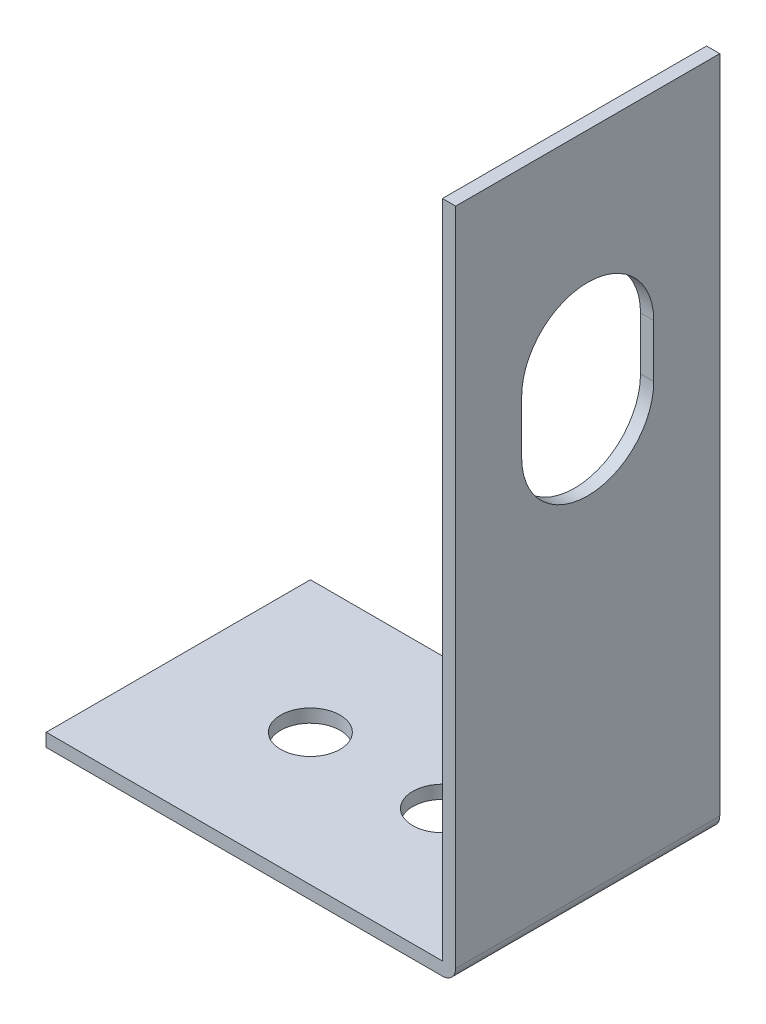
from build123d import *

# Parameters (mm, degrees)
EXTRUSION1_DEPTH        = 20
ENL_V_MAT_EXTRU_1_DEPTH = 62.64414003
ESQUISSE3_R             = 2.25
ENL_V_MAT_EXTRU_2_DEPTH = 62.64414003


with BuildPart() as part:
    # Esquisse1 → Extrusion1 (new body)
    with BuildSketch(Plane.XY):
        with BuildLine():
            Line((0, 0), (0, 50))
            Line((0, 50), (1, 50))
            Line((1, 50), (1, 0))
            ThreePointArc((1, 0), (0.707106781, -0.707106781), (0, -1))
            Line((0, -1), (-30, -1))
            Line((-30, -1), (-30, 0))
            Line((-30, 0), (0, 0))
        make_face()
    extrude(amount=EXTRUSION1_DEPTH)

    # Esquisse2 → Enlèv. mat.-Extru.1 (cut, through all)
    with BuildSketch(Plane.ZY):
        with BuildLine():
            Line((5, 35), (5, 31))
            ThreePointArc((5, 31), (10, 26), (15, 31))
            Line((15, 31), (15, 35))
            ThreePointArc((15, 35), (10, 40), (5, 35))
        make_face()
    extrude(amount=-ENL_V_MAT_EXTRU_1_DEPTH, mode=Mode.SUBTRACT)

    # Esquisse3 → Enlèv. mat.-Extru.2 (cut, through all)
    with BuildSketch(Plane(origin=(0, 0, 0), x_dir=(-1, 0, 0), z_dir=(0, 1, 0))):
        with Locations((10, 10)):
            Circle(ESQUISSE3_R)
        with Locations((20, 10)):
            Circle(ESQUISSE3_R)
    extrude(amount=-ENL_V_MAT_EXTRU_2_DEPTH, mode=Mode.SUBTRACT)


solid = part.part
